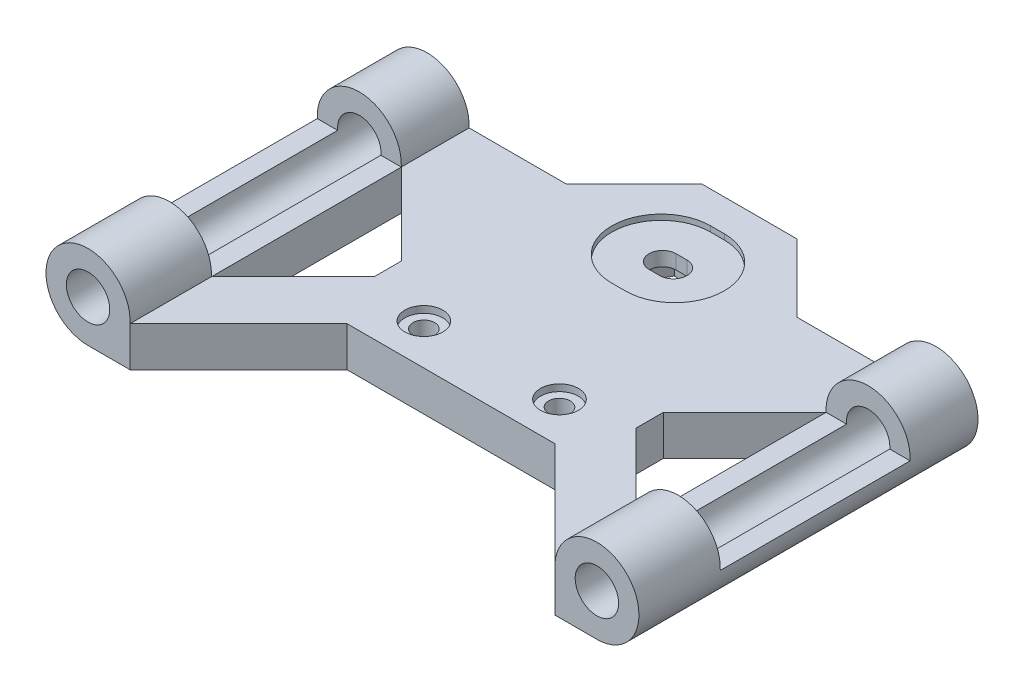
from build123d import *

# Parameters (mm, degrees)
SKETCH_1_R           = 3.1
SKETCH_1_R_2         = 1.6
EXTRUDE_1_DEPTH      = 25
EXTRUDE_2_DEPTH      = 2.945
CUT_EXTRUDE_1_DEPTH  = 56.64644355
CUT_EXTRUDE_START    = -1.5
CUT_EXTRUDE_4_DEPTH  = 1.5
SKETCH_6_R           = 0.8
CUT_EXTRUDE_5_DEPTH  = 56.64644355
CUT_EXTRUDE_6_DEPTH  = 56.64644355
SKETCH_9_W           = 14
SKETCH_9_H           = 3.255
CUT_EXTRUDE_9_DEPTH  = 46.904396246
SKETCH_10_R          = 1.4
CUT_EXTRUDE_11_DEPTH = 0.5
CUT_EXTRUDE_12_DEPTH = 0.4


with BuildPart() as part:
    # 草图1 → 凸台-拉伸1 (new body)
    # profile 1 of 3: a face of its own
    with BuildSketch(Plane.XY):
        with Locations((-46.507778168, 5.529205914)):
            Circle(SKETCH_1_R)
        with Locations((-46.507778168, 5.529205914)):
            Circle(SKETCH_1_R_2, mode=Mode.SUBTRACT)
    # profile 2 of 3: a face of its own
    with BuildSketch(Plane.XY):
        with BuildLine():
            ThreePointArc((-43.411655593, 5.374205914), (-44.371250611, 3.283042519), (-46.507778168, 2.429205914))
            Line((-46.507778168, 2.429205914), (-8.987778168, 2.429205914))
            ThreePointArc((-8.987778168, 2.429205914), (-11.124305724, 3.283042519), (-12.083900743, 5.374205914))
            Line((-12.083900743, 5.374205914), (-43.411655593, 5.374205914))
        make_face()
    # profile 3 of 3: a face of its own
    with BuildSketch(Plane.XY):
        with Locations((-8.987778168, 5.529205914)):
            Circle(SKETCH_1_R)
        with Locations((-8.987778168, 5.529205914)):
            Circle(SKETCH_1_R_2, mode=Mode.SUBTRACT)
    extrude(amount=EXTRUDE_1_DEPTH)

    # 草图2 → 凸台-拉伸2 (add)
    with BuildSketch(Plane(origin=(0, 5.374205914, 0), x_dir=(1, 0, 0), z_dir=(0, 1, 0))):
        Polygon((-19.247778168, 0), (-24.247778168, 5), (-31.247778168, 5), (-36.247778168, 0), align=None)
    extrude(amount=-EXTRUDE_2_DEPTH)

    # 草图3 → 切除-拉伸1 (cut, through all)
    with BuildSketch(Plane(origin=(0, 5.374205914, 0), x_dir=(1, 0, 0), z_dir=(0, 1, 0))):
        with BuildLine():
            Line((-28.147778168, 0), (-27.347778168, 0))
            ThreePointArc((-27.347778168, 0), (-26.347778168, -1), (-27.347778168, -2))
            Line((-27.347778168, -2), (-28.147778168, -2))
            ThreePointArc((-28.147778168, -2), (-29.147778168, -1), (-28.147778168, 0))
        make_face()
    extrude(amount=-CUT_EXTRUDE_1_DEPTH, mode=Mode.SUBTRACT)

    # 草图5 → 切除-拉伸4 (cut)
    # profile 1 of 3: a face of its own
    with BuildSketch(Plane(origin=(0, 2.429205914, 0), x_dir=(-1, 0, 0), z_dir=(0, -1, 0)).offset(CUT_EXTRUDE_START)):
        Polygon((25.780642064, -1), (26.964210116, 1.05), (26.164210116, 1.05), (24.980642064, -1), (26.164210116, -3.05), (26.964210116, -3.05), align=None)
    # profile 2 of 3: a face of its own
    with BuildSketch(Plane(origin=(0, 2.429205914, 0), x_dir=(-1, 0, 0), z_dir=(0, -1, 0)).offset(CUT_EXTRUDE_START)):
        Polygon((28.53134622, -3.05), (29.714914272, -1), (28.53134622, 1.05), (26.964210116, 1.05), (25.780642064, -1), (26.964210116, -3.05), align=None)
        with BuildLine():
            ThreePointArc((27.347778168, -2), (26.347778168, -1), (27.347778168, 0))
            Line((27.347778168, 0), (28.147778168, 0))
            ThreePointArc((28.147778168, 0), (29.147778168, -1), (28.147778168, -2))
            Line((28.147778168, -2), (27.347778168, -2))
        make_face(mode=Mode.SUBTRACT)
    # profile 3 of 3: a face of its own
    with BuildSketch(Plane(origin=(0, 2.429205914, 0), x_dir=(-1, 0, 0), z_dir=(0, -1, 0)).offset(CUT_EXTRUDE_START)):
        Polygon((28.53134622, 1.05), (29.714914272, -1), (28.53134622, -3.05), (29.33134622, -3.05), (30.514914272, -1), (29.33134622, 1.05), align=None)
    extrude(amount=CUT_EXTRUDE_4_DEPTH, mode=Mode.SUBTRACT)

    # 草图6 → 切除-拉伸5 (cut, through all)
    with BuildSketch(Plane(origin=(0, 5.374205914, 0), x_dir=(1, 0, 0), z_dir=(0, 1, 0))):
        with Locations(Location((-32.747778168, -14, 0), (0, 0, 270))):
            Circle(SKETCH_6_R)
        with Locations(Location((-22.747778168, -14, 0), (0, 0, 270))):
            Circle(SKETCH_6_R)
    extrude(amount=-CUT_EXTRUDE_5_DEPTH, mode=Mode.SUBTRACT)

    # 草图7 → 切除-拉伸6 (cut, through all)
    with BuildSketch(Plane(origin=(0, 5.374205914, 0), x_dir=(1, 0, 0), z_dir=(0, 1, 0))):
        Polygon((-35.407778168, -17), (-43.407778168, -25), (-12.083900743, -25), (-20.083900743, -17), align=None)
        Polygon((-37.407778168, -13), (-37.407778168, -11), (-43.407778168, -5), (-43.407778168, -19), align=None)
        Polygon((-12.087778168, -5), (-18.087778168, -11), (-18.087778168, -13), (-12.087778168, -19), align=None)
    extrude(amount=-CUT_EXTRUDE_6_DEPTH, mode=Mode.SUBTRACT)

    # 草图9 → 切除-拉伸9 (cut, through all)
    with BuildSketch(Plane.ZY.offset(12.087778168)):
        with Locations((12, 7.001705914)):
            Rectangle(SKETCH_9_W, SKETCH_9_H)
    cut_extrude_9 = extrude(amount=-CUT_EXTRUDE_9_DEPTH, mode=Mode.SUBTRACT)

    # 镜向1: 切除-拉伸9 across plane
    add(cut_extrude_9.mirror(Plane(origin=(-27.747778168, 0, 0), x_dir=(0, 0, 1), z_dir=(1, 0, 0))), mode=Mode.SUBTRACT)

    # 草图10 → 切除-拉伸11 (cut)
    with BuildSketch(Plane(origin=(0, 5.374205914, 0), x_dir=(1, 0, 0), z_dir=(0, 1, 0))):
        with Locations(Location((-22.747778168, -14, 0), (0, 0, 270))):
            Circle(SKETCH_10_R)
        with Locations(Location((-32.747778168, -14, 0), (0, 0, 270))):
            Circle(SKETCH_10_R)
    extrude(amount=-CUT_EXTRUDE_11_DEPTH, mode=Mode.SUBTRACT)

    # 草图11 → 切除-拉伸12 (cut)
    with BuildSketch(Plane(origin=(0, 5.374205914, 0), x_dir=(1, 0, 0), z_dir=(0, 1, 0))):
        with BuildLine():
            Line((-27.247778168, -4.65), (-28.247778168, -4.65))
            ThreePointArc((-28.247778168, -4.65), (-31.897778168, -1), (-28.247778168, 2.65))
            Line((-28.247778168, 2.65), (-27.247778168, 2.65))
            ThreePointArc((-27.247778168, 2.65), (-23.597778168, -1), (-27.247778168, -4.65))
        make_face()
    extrude(amount=-CUT_EXTRUDE_12_DEPTH, mode=Mode.SUBTRACT)


solid = part.part
